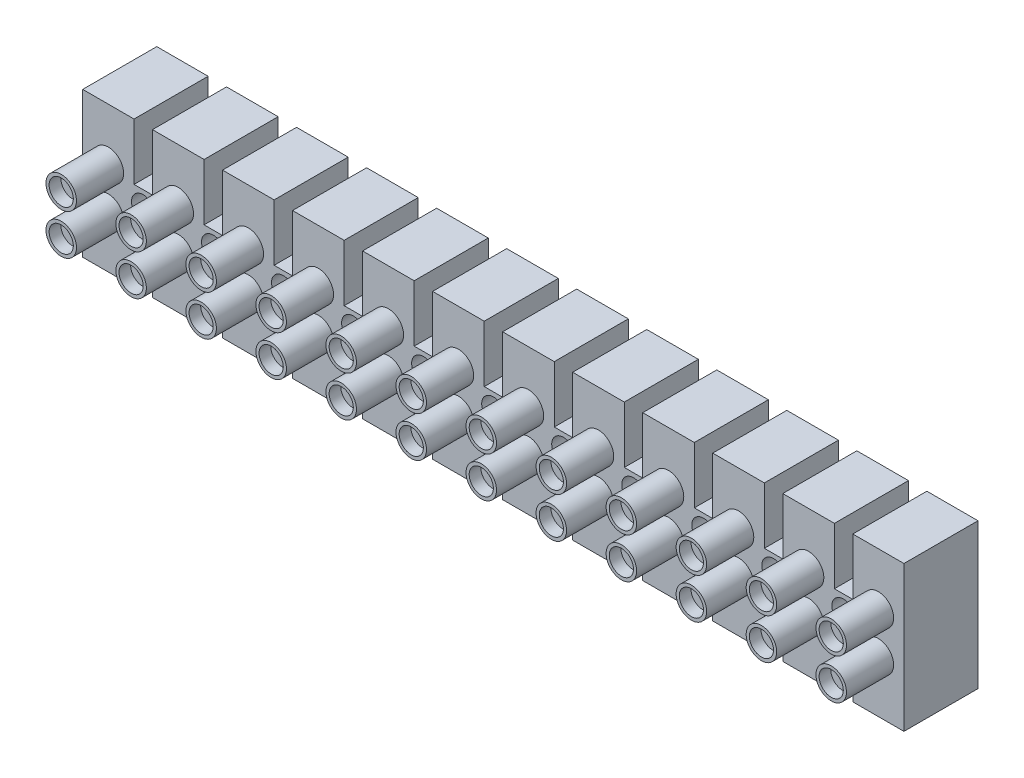
from build123d import *

# Parameters (mm, degrees)
SKETCH1_W           = 95.758
SKETCH1_H           = 16.9545
BOSS_EXTRUDE1_DEPTH = 8.636
SKETCH2_R           = 1.3716
SKETCH2_W           = 2.1463
SKETCH2_H           = 6.604
CUT_EXTRUDE2_DEPTH  = 8.636
SKETCH3_R           = 1.778
BOSS_EXTRUDE2_DEPTH = 5.4991
SKETCH4_R           = 1.4097
CUT_EXTRUDE3_DEPTH  = 1.3589


with BuildPart() as part:
    # Sketch1 → Boss-Extrude1 (new body)
    with BuildSketch(Plane.XY):
        with Locations((47.879, 8.47725)):
            Rectangle(SKETCH1_W, SKETCH1_H)
    extrude(amount=BOSS_EXTRUDE1_DEPTH)

    # Sketch2 → Cut-Extrude2 (cut)
    with BuildSketch(Plane.XY.offset(8.636)):
        with Locations((15.2273, 8.47725)):
            Circle(SKETCH2_R)
        with Locations((23.3934, 8.47725)):
            Circle(SKETCH2_R)
        with Locations((31.5595, 8.47725)):
            Circle(SKETCH2_R)
        with Locations((39.7256, 8.47725)):
            Circle(SKETCH2_R)
        with Locations((47.8917, 8.47725)):
            Circle(SKETCH2_R)
        with Locations((56.0578, 8.47725)):
            Circle(SKETCH2_R)
        with Locations((7.0612, 8.47725)):
            Circle(SKETCH2_R)
        with Locations((64.2239, 8.47725)):
            Circle(SKETCH2_R)
        with Locations((72.39, 8.47725)):
            Circle(SKETCH2_R)
        with Locations((80.5561, 8.47725)):
            Circle(SKETCH2_R)
        with Locations((88.7222, 8.47725)):
            Circle(SKETCH2_R)
        with Locations((23.3934, 13.6525)):
            Rectangle(SKETCH2_W, SKETCH2_H)
        with Locations((7.0612, 13.6525)):
            Rectangle(SKETCH2_W, SKETCH2_H)
        with Locations((15.2273, 13.6525)):
            Rectangle(SKETCH2_W, SKETCH2_H)
        with Locations((31.5595, 13.6525)):
            Rectangle(SKETCH2_W, SKETCH2_H)
        with Locations((39.7256, 13.6525)):
            Rectangle(SKETCH2_W, SKETCH2_H)
        with Locations((47.8917, 13.6525)):
            Rectangle(SKETCH2_W, SKETCH2_H)
        with Locations((56.0578, 13.6525)):
            Rectangle(SKETCH2_W, SKETCH2_H)
        with Locations((64.2239, 13.6525)):
            Rectangle(SKETCH2_W, SKETCH2_H)
        with Locations((72.39, 13.6525)):
            Rectangle(SKETCH2_W, SKETCH2_H)
        with Locations((80.5561, 13.6525)):
            Rectangle(SKETCH2_W, SKETCH2_H)
        with Locations((88.7222, 13.6525)):
            Rectangle(SKETCH2_W, SKETCH2_H)
        with Locations((7.0612, 3.302)):
            Rectangle(SKETCH2_W, SKETCH2_H)
        with Locations((15.2273, 3.302)):
            Rectangle(SKETCH2_W, SKETCH2_H)
        with Locations((23.3934, 3.302)):
            Rectangle(SKETCH2_W, SKETCH2_H)
        with Locations((31.5595, 3.302)):
            Rectangle(SKETCH2_W, SKETCH2_H)
        with Locations((39.7256, 3.302)):
            Rectangle(SKETCH2_W, SKETCH2_H)
        with Locations((47.8917, 3.302)):
            Rectangle(SKETCH2_W, SKETCH2_H)
        with Locations((56.0578, 3.302)):
            Rectangle(SKETCH2_W, SKETCH2_H)
        with Locations((64.2239, 3.302)):
            Rectangle(SKETCH2_W, SKETCH2_H)
        with Locations((72.39, 3.302)):
            Rectangle(SKETCH2_W, SKETCH2_H)
        with Locations((80.5561, 3.302)):
            Rectangle(SKETCH2_W, SKETCH2_H)
        with Locations((88.7222, 3.302)):
            Rectangle(SKETCH2_W, SKETCH2_H)
    extrude(amount=-CUT_EXTRUDE2_DEPTH, mode=Mode.SUBTRACT)

    # Sketch3 → Boss-Extrude2 (add)
    with BuildSketch(Plane.XY.offset(8.636)):
        with Locations((92.776675, 6.1087)):
            Circle(SKETCH3_R)
        with Locations((11.14425, 10.8458)):
            Circle(SKETCH3_R)
        with Locations((19.31035, 10.8458)):
            Circle(SKETCH3_R)
        with Locations((27.47645, 10.8458)):
            Circle(SKETCH3_R)
        with Locations((35.64255, 10.8458)):
            Circle(SKETCH3_R)
        with Locations((43.80865, 10.8458)):
            Circle(SKETCH3_R)
        with Locations((51.97475, 10.8458)):
            Circle(SKETCH3_R)
        with Locations((60.14085, 10.8458)):
            Circle(SKETCH3_R)
        with Locations((68.30695, 10.8458)):
            Circle(SKETCH3_R)
        with Locations((76.47305, 10.8458)):
            Circle(SKETCH3_R)
        with Locations((84.63915, 10.8458)):
            Circle(SKETCH3_R)
        with Locations((92.776675, 10.8458)):
            Circle(SKETCH3_R)
        with Locations((2.994025, 10.8458)):
            Circle(SKETCH3_R)
        with Locations((2.994025, 6.1087)):
            Circle(SKETCH3_R)
        with Locations((11.14425, 6.1087)):
            Circle(SKETCH3_R)
        with Locations((19.31035, 6.1087)):
            Circle(SKETCH3_R)
        with Locations((27.47645, 6.1087)):
            Circle(SKETCH3_R)
        with Locations((35.64255, 6.1087)):
            Circle(SKETCH3_R)
        with Locations((43.80865, 6.1087)):
            Circle(SKETCH3_R)
        with Locations((51.97475, 6.1087)):
            Circle(SKETCH3_R)
        with Locations((60.14085, 6.1087)):
            Circle(SKETCH3_R)
        with Locations((68.30695, 6.1087)):
            Circle(SKETCH3_R)
        with Locations((76.47305, 6.1087)):
            Circle(SKETCH3_R)
        with Locations((84.63915, 6.1087)):
            Circle(SKETCH3_R)
    extrude(amount=BOSS_EXTRUDE2_DEPTH)

    # Sketch4 → Cut-Extrude3 (cut)
    with BuildSketch(Plane.XY.offset(14.1351)):
        with Locations((11.14425, 6.1087)):
            Circle(SKETCH4_R)
        with Locations((19.31035, 6.1087)):
            Circle(SKETCH4_R)
        with Locations((27.47645, 6.1087)):
            Circle(SKETCH4_R)
        with Locations((35.64255, 6.1087)):
            Circle(SKETCH4_R)
        with Locations((43.80865, 6.1087)):
            Circle(SKETCH4_R)
        with Locations((51.97475, 6.1087)):
            Circle(SKETCH4_R)
        with Locations((60.14085, 6.1087)):
            Circle(SKETCH4_R)
        with Locations((68.30695, 6.1087)):
            Circle(SKETCH4_R)
        with Locations((76.47305, 6.1087)):
            Circle(SKETCH4_R)
        with Locations((84.63915, 6.1087)):
            Circle(SKETCH4_R)
        with Locations((92.776675, 6.1087)):
            Circle(SKETCH4_R)
        with Locations((92.776675, 10.8458)):
            Circle(SKETCH4_R)
        with Locations((84.63915, 10.8458)):
            Circle(SKETCH4_R)
        with Locations((76.47305, 10.8458)):
            Circle(SKETCH4_R)
        with Locations((68.30695, 10.8458)):
            Circle(SKETCH4_R)
        with Locations((60.14085, 10.8458)):
            Circle(SKETCH4_R)
        with Locations((51.97475, 10.8458)):
            Circle(SKETCH4_R)
        with Locations((43.80865, 10.8458)):
            Circle(SKETCH4_R)
        with Locations((35.64255, 10.8458)):
            Circle(SKETCH4_R)
        with Locations((27.47645, 10.8458)):
            Circle(SKETCH4_R)
        with Locations((19.31035, 10.8458)):
            Circle(SKETCH4_R)
        with Locations((11.14425, 10.8458)):
            Circle(SKETCH4_R)
        with Locations((2.994025, 10.8458)):
            Circle(SKETCH4_R)
        with Locations((2.994025, 6.1087)):
            Circle(SKETCH4_R)
    extrude(amount=-CUT_EXTRUDE3_DEPTH, mode=Mode.SUBTRACT)


solid = part.part
